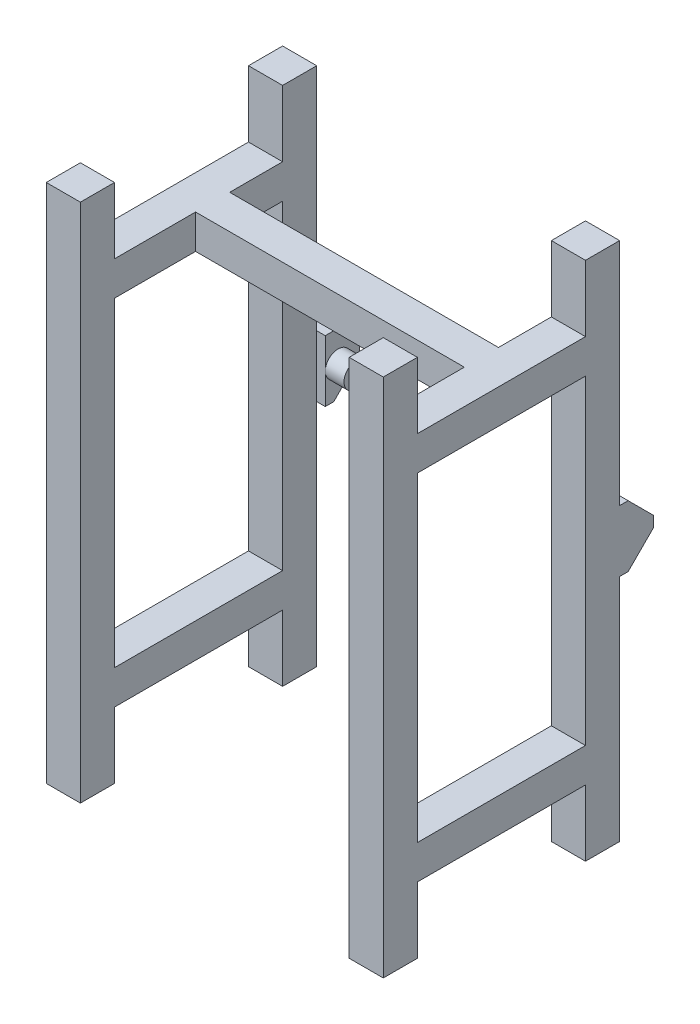
from build123d import *

# Parameters (mm, degrees)
SKETCH1_W                = 40
SKETCH1_H                = 40
BOSS_EXTRUDE1_DEPTH      = 610
BOSS_EXTRUDE1_2_DEPTH    = 610
BOSS_EXTRUDE1_3_DEPTH    = 610
BOSS_EXTRUDE1_4_DEPTH    = 610
SKETCH2_W                = 40
SKETCH2_H                = 40
BOSS_EXTRUDE2_DEPTH      = 237
BOSS_EXTRUDE3_REACH      = 721.241
SKETCH3_W                = 40
SKETCH3_H                = 40
SKETCH4_W                = 50
SKETCH4_H                = 72
BOSS_EXTRUDE4_DEPTH      = 40
CHAMFER1_SIZE            = 30
SKETCH5_R                = 15
BOSS_EXTRUDE5_DEPTH      = 22
CHAMFER1_OF_MIRROR1_SIZE = 30


with BuildPart() as part:
    # Sketch1 → Boss-Extrude1 (new body)
    with BuildSketch(Plane(origin=(0, 0, 0), x_dir=(1, 0, 0), z_dir=(0, 1, 0))):
        with Locations((-177.5, 118.5)):
            Rectangle(SKETCH1_W, SKETCH1_H)
    extrude(amount=BOSS_EXTRUDE1_DEPTH)



with BuildPart() as body_2:
    # Sketch1 → Boss-Extrude1 2 (new body)
    with BuildSketch(Plane(origin=(0, 0, 0), x_dir=(1, 0, 0), z_dir=(0, 1, 0))):
        with Locations((177.5, 118.5)):
            Rectangle(SKETCH1_W, SKETCH1_H)
    extrude(amount=BOSS_EXTRUDE1_2_DEPTH)


with BuildPart() as body_3:
    # Sketch1 → Boss-Extrude1 3 (new body)
    with BuildSketch(Plane(origin=(0, 0, 0), x_dir=(1, 0, 0), z_dir=(0, 1, 0))):
        with Locations((177.5, -118.5)):
            Rectangle(SKETCH1_W, SKETCH1_H)
    extrude(amount=BOSS_EXTRUDE1_3_DEPTH)


with BuildPart() as body_4:
    # Sketch1 → Boss-Extrude1 4 (new body)
    with BuildSketch(Plane(origin=(0, 0, 0), x_dir=(1, 0, 0), z_dir=(0, 1, 0))):
        with Locations((-177.5, -118.5)):
            Rectangle(SKETCH1_W, SKETCH1_H)
    extrude(amount=BOSS_EXTRUDE1_4_DEPTH)


with BuildPart() as part_1:
    add(part.part)

    add(body_2.part)  # Boss-Extrude2 merges body 2

    add(body_3.part)  # Boss-Extrude2 merges body 3

    add(body_4.part)  # Boss-Extrude2 merges body 4
    # Sketch2 → Boss-Extrude2 (add)
    with BuildSketch(Plane(origin=(0, 0, 98.5), x_dir=(-1, 0, 0), z_dir=(0, 0, -1))):
        with Locations((177.5, 97.5)):
            Rectangle(SKETCH2_W, SKETCH2_H)
        with Locations((-177.5, 97.5)):
            Rectangle(SKETCH2_W, SKETCH2_H)
        with Locations((-177.5, 512.5)):
            Rectangle(SKETCH2_W, SKETCH2_H)
        with Locations((177.5, 512.5)):
            Rectangle(SKETCH2_W, SKETCH2_H)
    extrude(amount=BOSS_EXTRUDE2_DEPTH)

    # Sketch3 → Boss-Extrude3 (add, up to next)
    with BuildSketch(Plane(origin=(-157.5, 0, 0), x_dir=(0, 0, -1), z_dir=(1, 0, 0)), mode=Mode.PRIVATE) as boss_extrude3_sk1:
        with Locations((16.5, 512.5)):
            Rectangle(SKETCH3_W, SKETCH3_H)
    boss_extrude3_tool1 = extrude(boss_extrude3_sk1.sketch, amount=BOSS_EXTRUDE3_REACH, mode=Mode.PRIVATE) - part_1.part
    add(boss_extrude3_tool1.solids().sort_by_distance((-157.5, 512.5, -16.5))[0])

    # Sketch4 → Boss-Extrude4 (add)
    with BuildSketch(Plane(origin=(0, 0, -138.5), x_dir=(-1, 0, 0), z_dir=(0, 0, -1))):
        with Locations((172.5, 305)):
            Rectangle(SKETCH4_W, SKETCH4_H)
    boss_extrude4 = extrude(amount=BOSS_EXTRUDE4_DEPTH)

    # Chamfer1
    chamfer1_edges = [part_1.edges().sort_by_distance(p)[0] for p in [
        (-172.5, 341, -178.5),
        (-172.5, 269, -178.5),
    ]]
    chamfer(chamfer1_edges, length=CHAMFER1_SIZE)

    # Sketch5 → Boss-Extrude5 (add)
    with BuildSketch(Plane(origin=(-147.5, 0, 0), x_dir=(0, 0, -1), z_dir=(1, 0, 0))):
        with Locations(Location((153.5, 305, 0), (0, 0, 180))):
            Circle(SKETCH5_R)
    boss_extrude5 = extrude(amount=BOSS_EXTRUDE5_DEPTH)

    # Mirror1: Boss-Extrude4, Boss-Extrude5 across plane
    add(boss_extrude4.mirror(Plane(origin=(0, 0, 0), x_dir=(0, 0, 1), z_dir=(1, 0, 0))))
    add(boss_extrude5.mirror(Plane(origin=(0, 0, 0), x_dir=(0, 0, 1), z_dir=(1, 0, 0))))

    # Chamfer1 of Mirror1
    chamfer1_of_mirror1_edges = [part_1.edges().sort_by_distance(p)[0] for p in [
        (172.5, 341, -178.5),
        (172.5, 269, -178.5),
    ]]
    chamfer(chamfer1_of_mirror1_edges, length=CHAMFER1_OF_MIRROR1_SIZE)


solid = part_1.part
